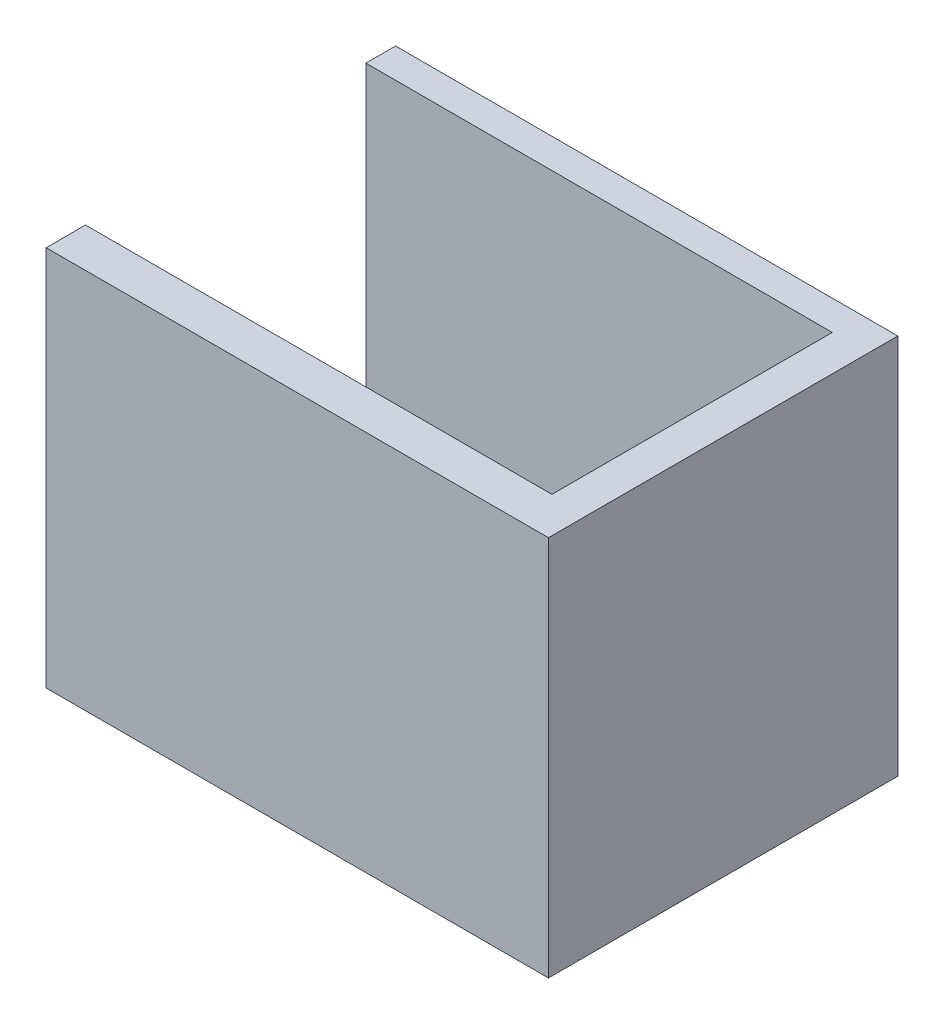
from build123d import *

# Parameters (mm, degrees)
BOSS_EXTRUDE1_DEPTH = 120
SKETCH2_W           = 158.061450485
SKETCH2_H           = 109.955791642
BOSS_EXTRUDE2_DEPTH = 5


with BuildPart() as part:
    # Sketch1 → Boss-Extrude1 (new body)
    with BuildSketch(Plane(origin=(0, 0, 0), x_dir=(1, 0, 0), z_dir=(0, 1, 0))):
        Polygon((-62.125022278, 33.67396119), (84.665959564, 33.67396119), (84.665959564, -54.565561602), (-62.125022278, -54.565561602), (-62.125022278, -66.935588162), (95.936428207, -66.935588162), (95.936428207, 43.02020348), (-62.125022278, 43.02020348), align=None)
    extrude(amount=BOSS_EXTRUDE1_DEPTH)

    # Sketch2 → Boss-Extrude2 (add)
    with BuildSketch(Plane.XZ):
        with Locations((16.905702965, 11.957692341)):
            Rectangle(SKETCH2_W, SKETCH2_H)
    extrude(amount=-BOSS_EXTRUDE2_DEPTH)


solid = part.part
